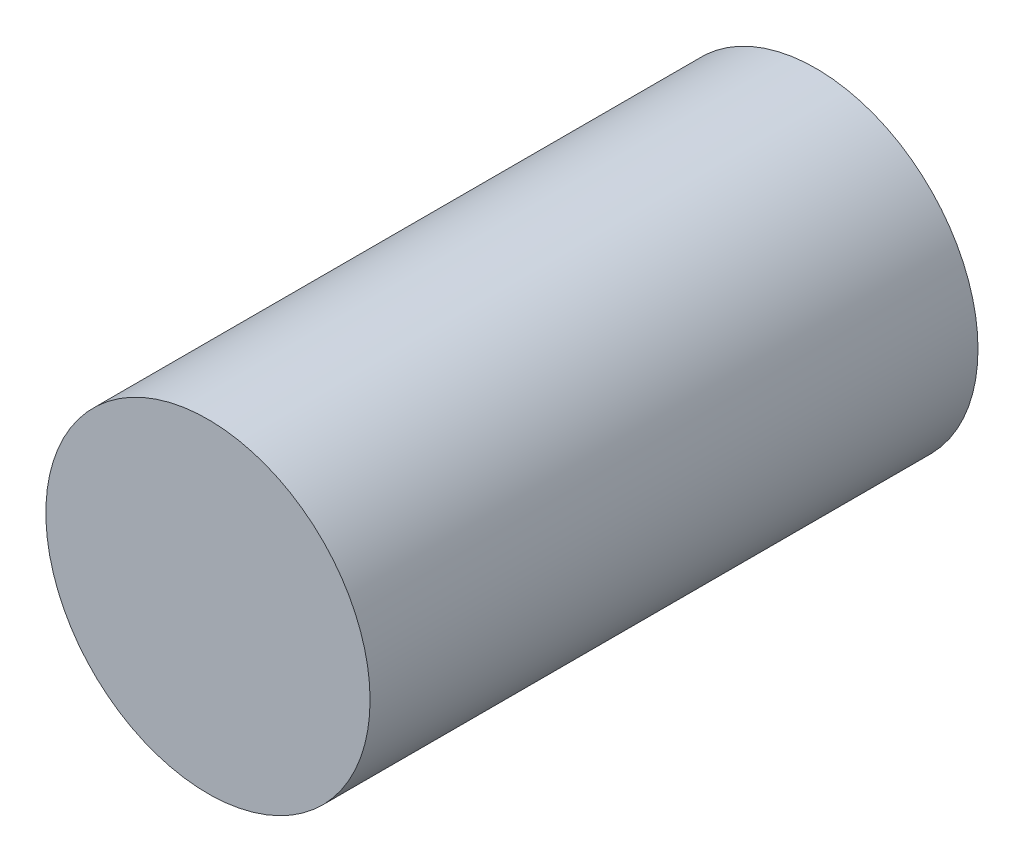
from build123d import *

# Parameters (mm, degrees)
SKETCH1_R           = 20
BOSS_EXTRUDE1_DEPTH = 75


with BuildPart() as part:
    # Sketch1 → Boss-Extrude1 (new body)
    with BuildSketch(Plane.XY):
        Circle(SKETCH1_R)
    extrude(amount=BOSS_EXTRUDE1_DEPTH)


solid = part.part
